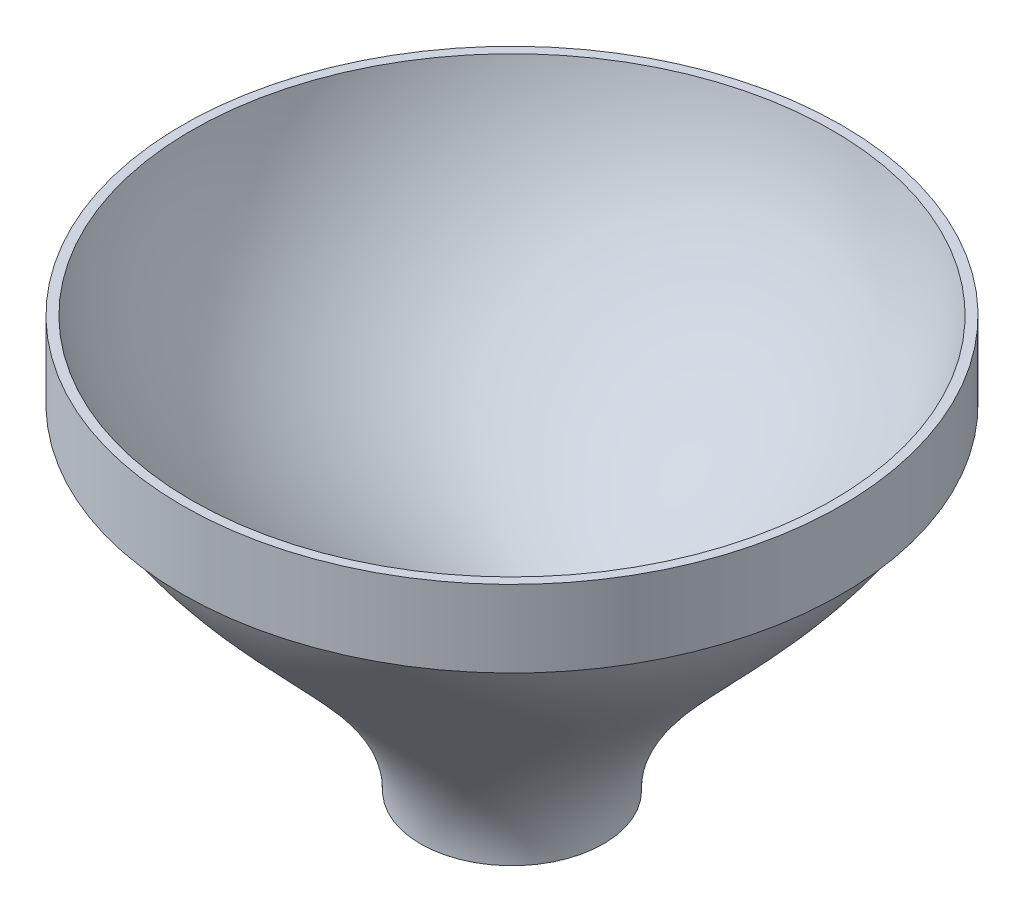
from build123d import *


with BuildPart() as part:
    # Sketch1 → Revolve1 (revolve)
    with BuildSketch(Plane.XY, mode=Mode.PRIVATE) as revolve1_sk:
        with BuildLine():
            Line((18.834212464, 99.875470661), (16.834212464, 99.875470661))
            add(Edge.make_bspline(
                [(-3.165787536, 129.16547318), (1.37248923, 118.835586105), (17.093188402, 110.044292054), (16.834212464, 99.875470661)],
                knots=[0, 0, 0, 0, 1, 1, 1, 1], degree=3))
            Line((-3.165787536, 129.16547318), (-3.965787536, 129.16547318))
            Line((-3.965787536, 129.16547318), (-3.965787536, 135.875470661))
            Line((-3.965787536, 135.875470661), (-3.165787536, 135.875470661))
            add(Edge.make_bspline(
                [(-3.165787536, 135.875470661), (0.490656023, 117.393768165), (18.125405427, 113.98015059), (18.834212464, 99.875470661)],
                knots=[0, 0, 0, 0, 1, 1, 1, 1], degree=3))
        make_face()
    revolve(revolve1_sk.sketch.rotate(Axis((24.834212464, 148.471380655, 0), (0, -1, 0)), 270), axis=Axis((24.834212464, 148.471380655, 0), (0, -1, 0)))


solid = part.part
